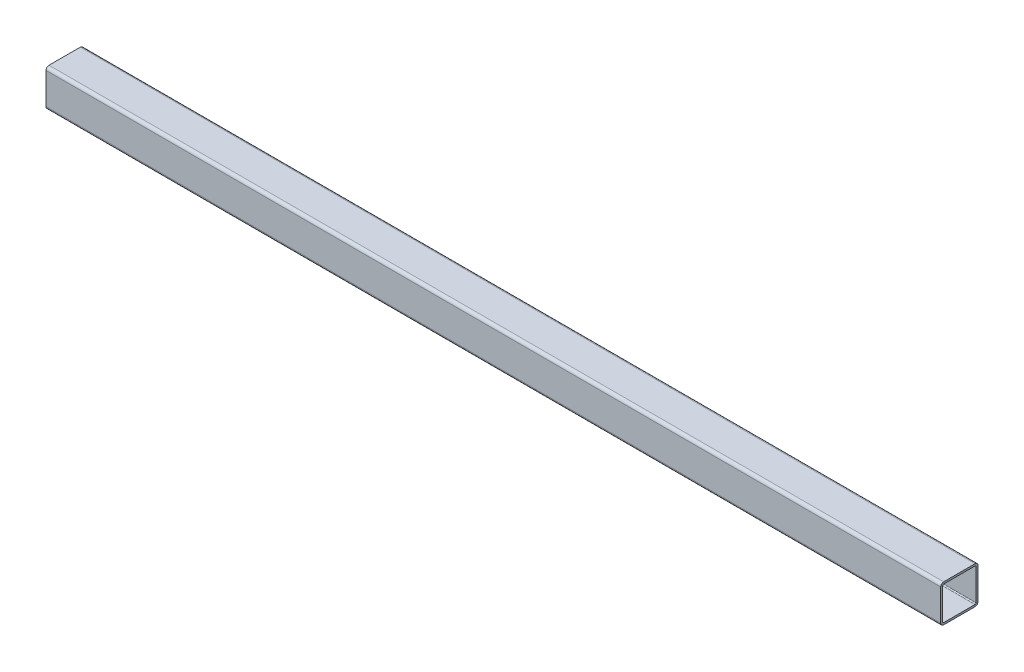
from build123d import *

# Parameters (mm, degrees)
BOSS_EXTRUDE1_DEPTH = 304.8
SCALE1_SCALE_X      = 1
SCALE1_SCALE_Y      = 0.4
SCALE1_SCALE_Z      = 0.4


with BuildPart() as part:
    # Sketch1 → Boss-Extrude1 (new body)
    with BuildSketch(Plane(origin=(0, 0, 0), x_dir=(0, 0, -1), z_dir=(1, 0, 0))):
        with BuildLine():
            Line((0, 2.54), (0, 29.21))
            ThreePointArc((0, 29.21), (-0.743948776, 31.006051224), (-2.54, 31.75))
            Line((-2.54, 31.75), (-29.21, 31.75))
            ThreePointArc((-29.21, 31.75), (-31.006051224, 31.006051224), (-31.75, 29.21))
            Line((-31.75, 29.21), (-31.75, 2.54))
            ThreePointArc((-31.75, 2.54), (-31.006051224, 0.743948776), (-29.21, 0))
            Line((-29.21, 0), (-2.54, 0))
            ThreePointArc((-2.54, 0), (-0.743948776, 0.743948776), (0, 2.54))
        make_face()
        with BuildLine():
            Line((-1.651, 2.54), (-1.651, 29.21))
            ThreePointArc((-1.651, 29.21), (-1.911382072, 29.838617928), (-2.54, 30.099))
            Line((-2.54, 30.099), (-29.21, 30.099))
            ThreePointArc((-29.21, 30.099), (-29.838617928, 29.838617928), (-30.099, 29.21))
            Line((-30.099, 29.21), (-30.099, 2.54))
            ThreePointArc((-30.099, 2.54), (-29.838617928, 1.911382072), (-29.21, 1.651))
            Line((-29.21, 1.651), (-2.54, 1.651))
            ThreePointArc((-2.54, 1.651), (-1.911382072, 1.911382072), (-1.651, 2.54))
        make_face(mode=Mode.SUBTRACT)
    extrude(amount=BOSS_EXTRUDE1_DEPTH)


with BuildPart() as part_1:
    # Scale1: scaled about (152.4, 15.875, 15.875)
    add(part.part.scale((SCALE1_SCALE_X, SCALE1_SCALE_Y, SCALE1_SCALE_Z), about=(152.4, 15.875, 15.875)))


solid = part_1.part
